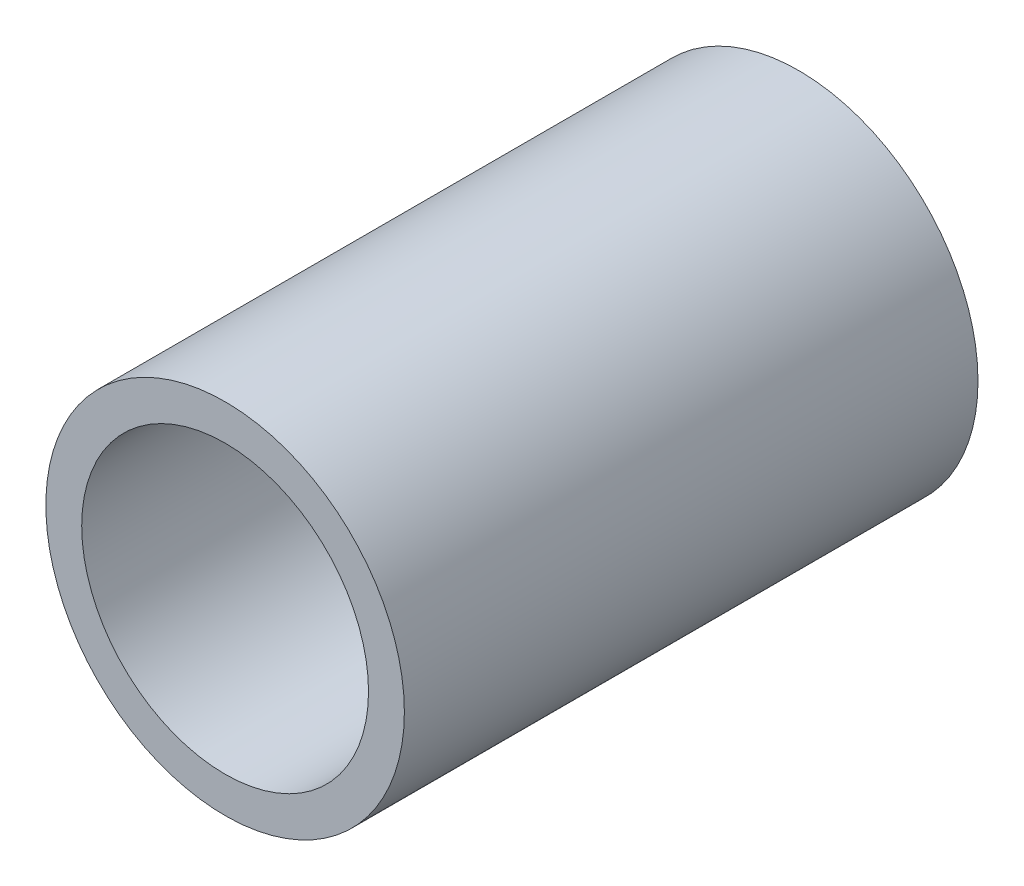
from build123d import *

# Parameters (mm, degrees)
SKETCH1_R           = 7.5
SKETCH1_R_2         = 6
BOSS_EXTRUDE1_DEPTH = 24


with BuildPart() as part:
    # Sketch1 → Boss-Extrude1 (new body)
    with BuildSketch(Plane.XY):
        Circle(SKETCH1_R)
        Circle(SKETCH1_R_2, mode=Mode.SUBTRACT)
    extrude(amount=BOSS_EXTRUDE1_DEPTH)


solid = part.part
